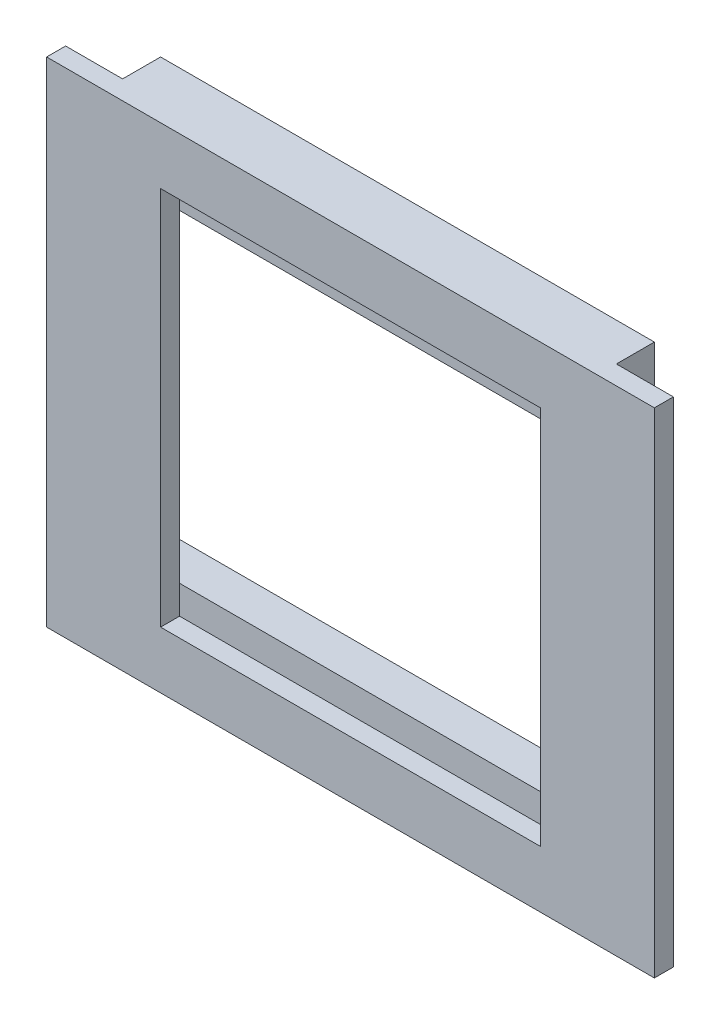
from build123d import *

# Parameters (mm, degrees)
SKETCH1_W           = 130
SKETCH1_H           = 130
BOSS_EXTRUDE1_DEPTH = 15
SKETCH2_W           = 15
SKETCH2_H           = 130
BOSS_EXTRUDE2_DEPTH = 5
CUT_EXTRUDE2_DEPTH  = 5
CUT_EXTRUDE3_DEPTH  = 120.725284495
SKETCH8_W           = 27
SKETCH8_H           = 85
CUT_EXTRUDE5_DEPTH  = 10


with BuildPart() as part:
    # Sketch1 → Boss-Extrude1 (new body)
    with BuildSketch(Plane.XY):
        with Locations((-9.518828452, -13.870292887)):
            Rectangle(SKETCH1_W, SKETCH1_H)
    extrude(amount=BOSS_EXTRUDE1_DEPTH)

    # Sketch2 → Boss-Extrude2 (add)
    with BuildSketch(Plane.XY.offset(15)):
        with Locations((62.981171548, -13.870292887)):
            Rectangle(SKETCH2_W, SKETCH2_H)
        with Locations((-82.018828452, -13.870292887)):
            Rectangle(SKETCH2_W, SKETCH2_H)
    extrude(amount=-BOSS_EXTRUDE2_DEPTH)

    # Sketch3 → Cut-Extrude2 (cut)
    with BuildSketch(Plane.XY.offset(15)):
        Polygon((-9.518828452, -13.870292887), (-59.518828452, 26.754707113), (-59.518828452, -54.495292887), align=None)
        Polygon((-59.518828452, 36.129707113), (-59.518828452, 26.754707113), (-9.518828452, -13.870292887), (40.481171548, 26.754707113), (40.481171548, 36.129707113), align=None)
        Polygon((40.481171548, -54.495292887), (-9.518828452, -13.870292887), (-59.518828452, -54.495292887), (-59.518828452, -63.870292887), (40.481171548, -63.870292887), align=None)
        Polygon((40.481171548, 26.754707113), (-9.518828452, -13.870292887), (40.481171548, -54.495292887), align=None)
    extrude(amount=-CUT_EXTRUDE2_DEPTH, mode=Mode.SUBTRACT)

    # Sketch5 → Cut-Extrude3 (cut, through all)
    with BuildSketch(Plane.XY.offset(10)):
        Polygon((-47.518828452, 24.129707113), (-47.518828452, -51.870292887), (-9.518828452, -13.870292887), align=None)
        Polygon((-47.518828452, 24.129707113), (-9.518828452, -13.870292887), (28.481171548, 24.129707113), (28.481171548, 28.629707113), (-47.518828452, 28.629707113), align=None)
        Polygon((28.481171548, 24.129707113), (-9.518828452, -13.870292887), (28.481171548, -51.870292887), align=None)
        Polygon((-9.518828452, -13.870292887), (-47.518828452, -51.870292887), (-47.518828452, -56.370292887), (28.481171548, -56.370292887), (28.481171548, -51.870292887), align=None)
    extrude(amount=-CUT_EXTRUDE3_DEPTH, mode=Mode.SUBTRACT)

    # Sketch8 → Cut-Extrude5 (cut)
    with BuildSketch(Plane(origin=(0, 0, 0), x_dir=(-1, 0, 0), z_dir=(0, 0, -1))):
        with Locations((61.018828452, -13.870292887)):
            Rectangle(SKETCH8_W, SKETCH8_H)
        with Locations((-41.981171548, -13.870292887)):
            Rectangle(SKETCH8_W, SKETCH8_H)
    extrude(amount=-CUT_EXTRUDE5_DEPTH, mode=Mode.SUBTRACT)


solid = part.part
